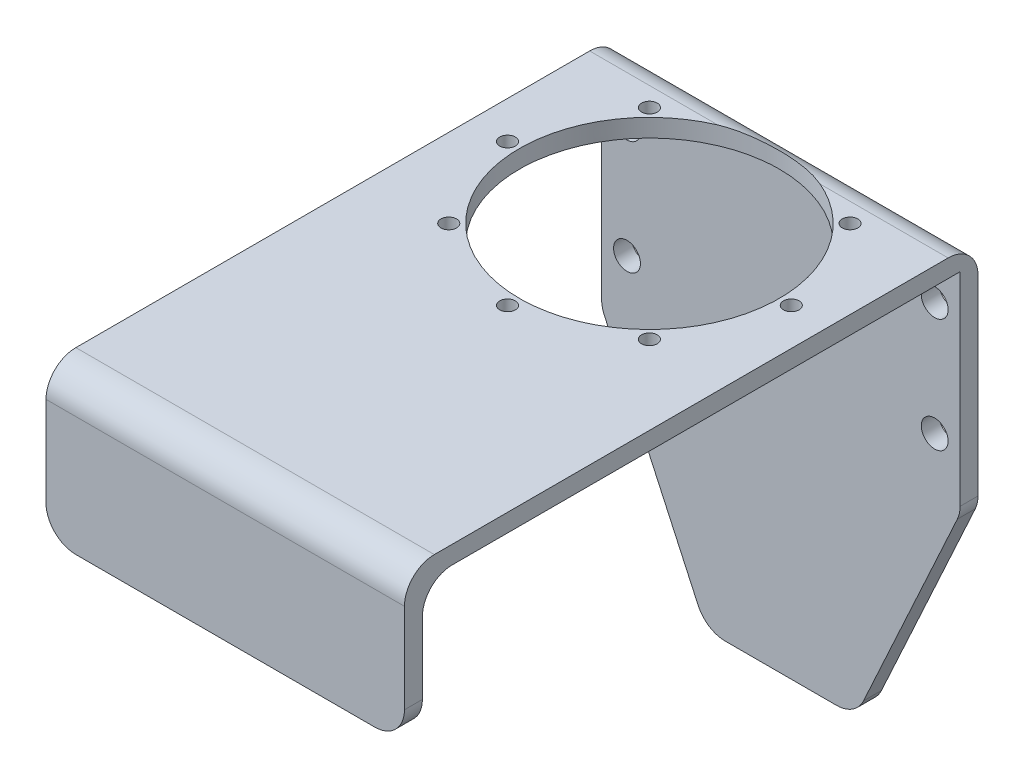
from build123d import *

# Parameters (mm, degrees)
CROQUIS1_R              = 4.5
SALIENTE_EXTRUIR1_DEPTH = 6
CROQUIS2_W              = 120
CROQUIS2_H              = 6
SALIENTE_EXTRUIR2_DEPTH = 186
CROQUIS3_W              = 120
CROQUIS3_H              = 44
SALIENTE_EXTRUIR3_DEPTH = 6
REDONDEO1_R             = 10
CROQUIS4_R              = 2.621
CORTAR_EXTRUIR1_DEPTH   = 259.417772547


with BuildPart() as part:
    # Croquis1 → Saliente-Extruir1 (new body)
    with BuildSketch(Plane.XY):
        Polygon((-92.102036721, -168.3), (-57.102036721, -244.5), (-7.102036721, -244.5), (27.897963279, -168.3), (27.897963279, -92.1), (-92.102036721, -92.1), align=None)
        with Locations((-83.602036721, -111.15)):
            Circle(CROQUIS1_R, mode=Mode.SUBTRACT)
        with Locations(Location((-83.602036721, -149.25, 0), (0, 0, 180))):
            Circle(CROQUIS1_R, mode=Mode.SUBTRACT)
        with Locations((19.397963279, -149.25)):
            Circle(CROQUIS1_R, mode=Mode.SUBTRACT)
        with Locations(Location((19.397963279, -111.15, 0), (0, 0, 180))):
            Circle(CROQUIS1_R, mode=Mode.SUBTRACT)
    extrude(amount=SALIENTE_EXTRUIR1_DEPTH)

    # Croquis2 → Saliente-Extruir2 (add)
    with BuildSketch(Plane.XY.offset(6)):
        with Locations((-32.102036721, -95.1)):
            Rectangle(CROQUIS2_W, CROQUIS2_H)
    extrude(amount=SALIENTE_EXTRUIR2_DEPTH)

    # Croquis3 → Saliente-Extruir3 (add)
    with BuildSketch(Plane.XY.offset(192)):
        with Locations((-32.102036721, -120.1)):
            Rectangle(CROQUIS3_W, CROQUIS3_H)
    extrude(amount=-SALIENTE_EXTRUIR3_DEPTH)

    # Redondeo1
    redondeo1_edges = [part.edges().sort_by_distance(p)[0] for p in [
        (27.897963279, -168.3, 3),
        (-7.102036721, -244.5, 3),
        (-57.102036721, -244.5, 3),
        (-92.102036721, -168.3, 3),
        (-32.102036721, -92.1, 192),
        (-92.102036721, -142.1, 189),
        (-32.102036721, -98.1, 186),
        (27.897963279, -142.1, 189),
        (-32.102036721, -92.1, 0),
    ]]
    fillet(redondeo1_edges, radius=REDONDEO1_R)

    # Croquis4 → Cortar-Extruir1 (cut, through all)
    with BuildSketch(Plane.XZ.offset(98.1)):
        with Locations(Location((1.485535385, 83.587572106, 0), (0, 0, 270))):
            Circle(CROQUIS4_R)
        with Locations(Location((-65.689608828, 16.412427894, 0), (0, 0, 270))):
            Circle(CROQUIS4_R)
        with Locations(Location((15.397963279, 50, 0), (0, 0, 270))):
            Circle(CROQUIS4_R)
        with Locations(Location((1.485535385, 16.412427894, 0), (0, 0, 270))):
            Circle(CROQUIS4_R)
        with Locations(Location((-65.689608828, 83.587572106, 0), (0, 0, 270))):
            Circle(CROQUIS4_R)
        with Locations(Location((-32.102036721, 97.5, 0), (0, 0, 270))):
            Circle(CROQUIS4_R)
        with Locations(Location((-79.602036721, 50, 0), (0, 0, 270))):
            Circle(CROQUIS4_R)
        with BuildLine():
            add(Edge.make_bspline(
                [(-32.102036721, 6.5), (-30.775341976, 6.499993534), (-28.122039283, 6.620682339), (-24.096613371, 7.177840976), (-20.062551193, 8.127248902), (-16.009319538, 9.510205402), (-12.057431762, 11.308759473), (-8.231122582, 13.545008905), (-4.625202085, 16.175326085), (-1.288566333, 19.186782917), (1.722751008, 22.523306389), (4.353148795, 26.129382286), (6.589284057, 29.95555323), (8.387887512, 33.907608072), (9.770762576, 37.960684071), (10.720181934, 41.994878278), (11.277273839, 46.020137925), (11.45831212, 50.000176972), (11.277257351, 53.980039938), (10.720117639, 58.005467444), (9.770712855, 62.03948534), (8.387758304, 66.092717236), (6.589203689, 70.044604944), (4.352954406, 73.870914143), (1.722637185, 77.476834635), (-1.288819636, 80.813470389), (-4.62534311, 83.824787729), (-8.231419007, 86.455185516), (-12.057589951, 88.691320778), (-16.009644794, 90.489924234), (-20.062720792, 91.872799297), (-24.096914999, 92.822218655), (-28.122174647, 93.37931056), (-32.102213693, 93.560348842), (-36.082076659, 93.379294072), (-40.107504165, 92.82215436), (-44.141522061, 91.872749576), (-48.194753957, 90.489795025), (-52.146641666, 88.691240411), (-55.972950865, 86.454991127), (-59.578871356, 83.824673906), (-62.91550711, 80.813217085), (-65.92682445, 77.476693611), (-68.557222237, 73.870617714), (-70.7933575, 70.04444677), (-72.591960955, 66.092391928), (-73.974836018, 62.039315929), (-74.924255376, 58.005121722), (-75.481347281, 53.979862075), (-75.662385563, 49.999823028), (-75.481330794, 46.019960062), (-74.924191081, 41.994532556), (-73.974786297, 37.96051466), (-72.591831746, 33.907282764), (-70.793277132, 29.955395056), (-68.557027848, 26.129085856), (-65.926710628, 22.523165366), (-62.915253807, 19.186529609), (-59.578730331, 16.17521228), (-55.972654439, 13.544814452), (-52.146483477, 11.308679338), (-48.194428701, 9.51007534), (-44.141352462, 8.127202224), (-40.107202532, 7.177786011), (-36.081941291, 6.620713021), (-33.428642641, 6.500006466), (-32.102036721, 6.5)],
                knots=[0, 0, 0, 0, 0.014562552, 0.029124133, 0.044561437, 0.059996822, 0.076077508, 0.092156266, 0.108579119, 0.125000004, 0.141422857, 0.157843742, 0.173924427, 0.190003186, 0.20544049, 0.220875875, 0.235438912, 0.250000004, 0.264563041, 0.279124133, 0.294561437, 0.309996822, 0.326077508, 0.342156266, 0.358579119, 0.375000004, 0.391422857, 0.407843742, 0.423924427, 0.440003186, 0.45544049, 0.470875875, 0.485438912, 0.500000004, 0.514563041, 0.529124133, 0.544561437, 0.559996822, 0.576077508, 0.592156266, 0.608579119, 0.625000004, 0.641422857, 0.657843742, 0.673924427, 0.690003186, 0.70544049, 0.720875875, 0.735438912, 0.750000004, 0.764563041, 0.779124133, 0.794561437, 0.809996822, 0.826077508, 0.842156266, 0.858579119, 0.875000004, 0.891422857, 0.907843742, 0.923924427, 0.940003186, 0.95544049, 0.970875875, 0.985438423, 1, 1, 1, 1], degree=3))
        make_face()
    extrude(amount=-CORTAR_EXTRUIR1_DEPTH, mode=Mode.SUBTRACT)


solid = part.part
